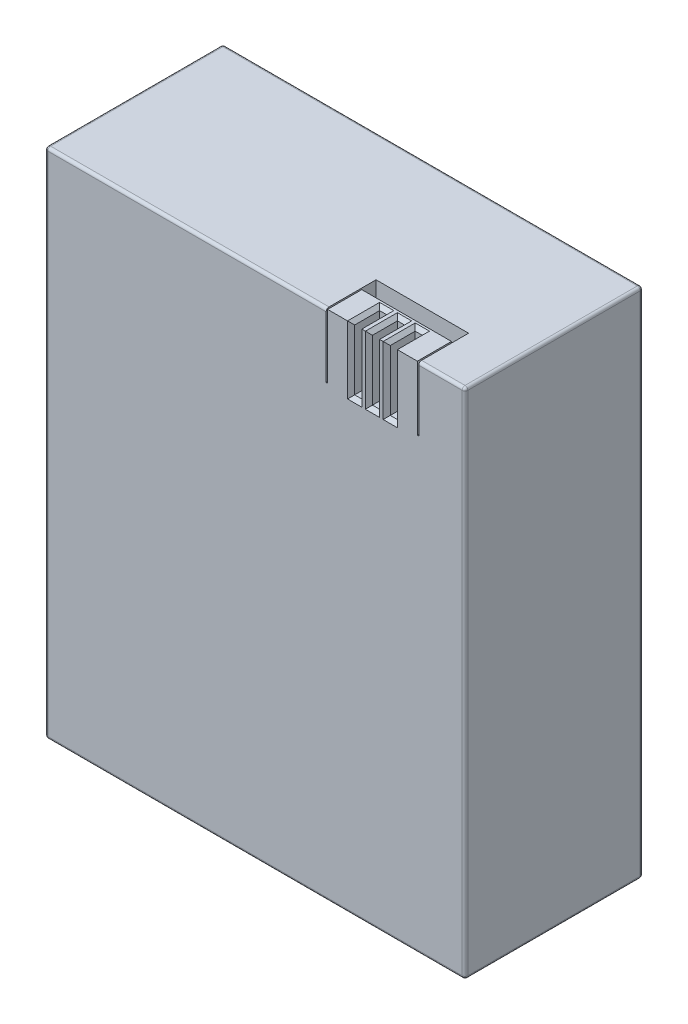
from build123d import *

# Parameters (mm, degrees)
SKETCH1_W           = 29.5
SKETCH1_H           = 36
BOSS_EXTRUDE1_DEPTH = 12.5
SKETCH3_W           = 0.5
SKETCH3_H           = 5.122612704
SKETCH3_H_2         = 5.427477651
CUT_EXTRUDE1_DEPTH  = 2
CHAMFER1_SIZE       = 0.25
CUT_EXTRUDE2_DEPTH  = 4.5
FILLET1_R           = 0.2


with BuildPart() as part:
    # Sketch1 → Boss-Extrude1 (new body)
    with BuildSketch(Plane.XY):
        Rectangle(SKETCH1_W, SKETCH1_H)
    extrude(amount=BOSS_EXTRUDE1_DEPTH)

    # Sketch3 → Cut-Extrude1 (cut)
    with BuildSketch(Plane.XY.offset(12.5)):
        Polygon((8.5, 15.5), (8.5, 18.622612704), (8, 18.622612704), (8, 15.5), (8, 13.5), (8.5, 13.5), align=None)
        with Locations((9.5, 16.061306352)):
            Rectangle(SKETCH3_W, SKETCH3_H)
        with Locations((7, 16.213738826)):
            Rectangle(SKETCH3_W, SKETCH3_H_2)
    extrude(amount=-CUT_EXTRUDE1_DEPTH, mode=Mode.SUBTRACT)

    # Chamfer1
    chamfer1_edges = [part.edges().sort_by_distance(p)[0] for p in [
        (8, 15.75, 12.5),
        (8.25, 18, 10.5),
        (8.5, 15.75, 12.5),
        (8.25, 13.5, 12.5),
        (8.5, 18, 11.5),
        (8, 18, 11.5),
        (6.75, 15.75, 12.5),
        (9.25, 15.75, 12.5),
        (7, 18, 10.5),
        (9.5, 18, 10.5),
        (9.75, 15.75, 12.5),
        (9.5, 13.5, 12.5),
        (9.25, 18, 11.5),
        (9.75, 18, 11.5),
        (7.25, 15.75, 12.5),
        (7, 13.5, 12.5),
        (6.75, 18, 11.5),
        (7.25, 18, 11.5),
    ]]
    chamfer(chamfer1_edges, length=CHAMFER1_SIZE)

    # Sketch4 → Cut-Extrude2 (cut)
    with BuildSketch(Plane(origin=(0, 18, 0), x_dir=(1, 0, 0), z_dir=(0, 1, 0))):
        Polygon((5, -9), (11.5, -9), (11.5, -12.5), (11.5, -13.590293159), (11.4, -13.590293159), (11.4, -13.5), (11.4, -10.1), (5.1, -10.1), (5.1, -13.5), (5.1, -13.548678846), (5, -13.548678846), (5, -13.5), align=None)
    extrude(amount=-CUT_EXTRUDE2_DEPTH, mode=Mode.SUBTRACT)

    # Fillet1
    fillet1_edges = [part.edges().sort_by_distance(p)[0] for p in [
        (14.75, 0, 12.5),
        (-4.875, 18, 12.5),
        (13.125, 18, 12.5),
        (-14.75, 0, 12.5),
        (0, 18, 0),
        (14.75, 0, 0),
        (0, -18, 0),
        (-14.75, 0, 0),
        (0, -18, 12.5),
        (-14.75, 18, 6.25),
        (14.75, 18, 6.25),
        (14.75, -18, 6.25),
        (-14.75, -18, 6.25),
    ]]
    fillet(fillet1_edges, radius=FILLET1_R)


solid = part.part
